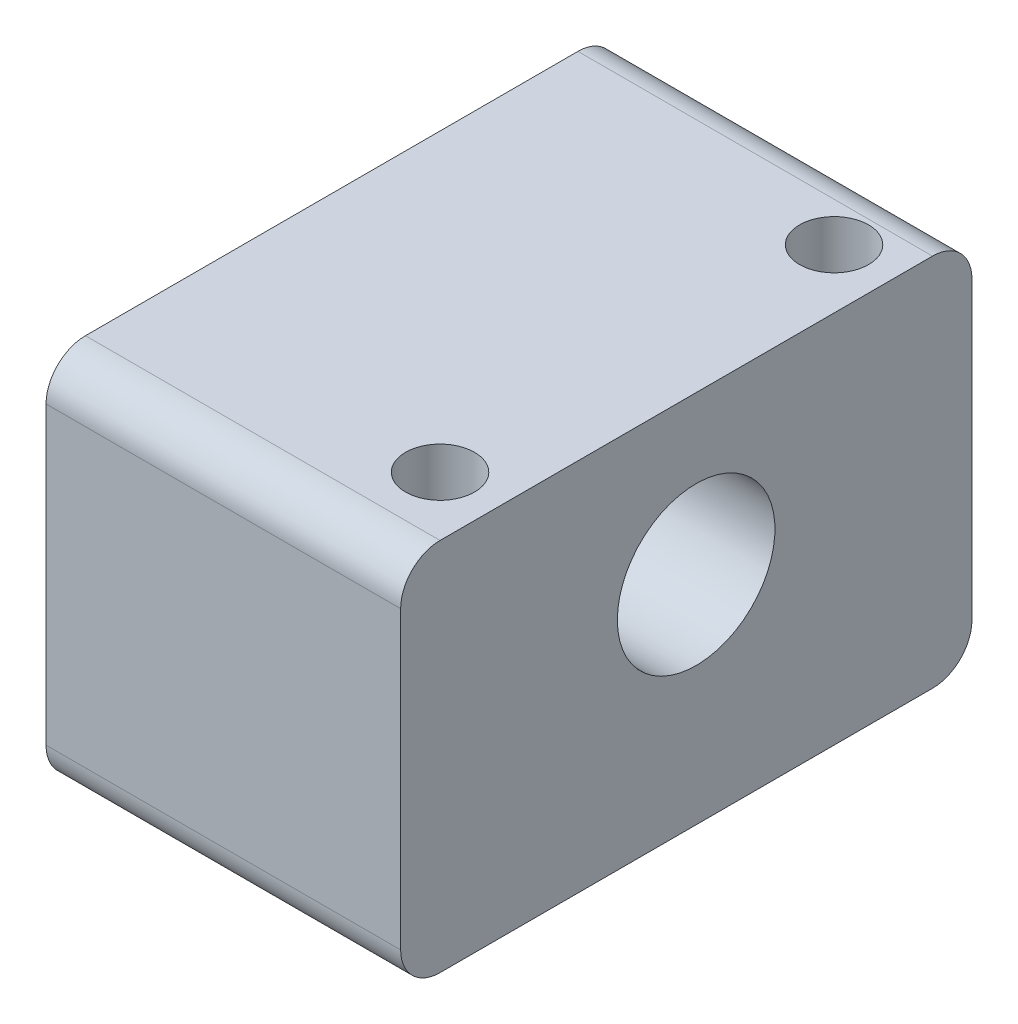
from build123d import *

# Parameters (mm, degrees)
SKETCH_1_W          = 18
SKETCH_1_H          = 29
SKETCH_1_R          = 1.75
EXTRUDE_1_DEPTH     = 19
SKETCH_2_R          = 4
CUT_EXTRUDE_1_DEPTH = 20
FILLET_1_R          = 2


with BuildPart() as part:
    # 草图1 → 凸台-拉伸1 (new body)
    with BuildSketch(Plane(origin=(0, 0, 0), x_dir=(1, 0, 0), z_dir=(0, 1, 0))):
        with Locations((0, 24.5)):
            Rectangle(SKETCH_1_W, SKETCH_1_H)
        with Locations(Location((6, 15, 0), (0, 0, 270))):
            Circle(SKETCH_1_R, mode=Mode.SUBTRACT)
        with Locations(Location((6, 35, 0), (0, 0, 270))):
            Circle(SKETCH_1_R, mode=Mode.SUBTRACT)
    extrude(amount=EXTRUDE_1_DEPTH)

    # 草图2 → 切除-拉伸1 (cut)
    with BuildSketch(Plane.ZY.offset(9)):
        with Locations((-25, 11)):
            Circle(SKETCH_2_R)
        with Locations((-5, 11)):
            Circle(SKETCH_2_R)
    extrude(amount=-CUT_EXTRUDE_1_DEPTH, mode=Mode.SUBTRACT)

    # 圆角1
    fillet_1_edges = [part.edges().sort_by_distance(p)[0] for p in [
        (0, 19, -10),
        (0, 0, -10),
        (0, 0, -39),
        (0, 19, -39),
    ]]
    fillet(fillet_1_edges, radius=FILLET_1_R)


solid = part.part
